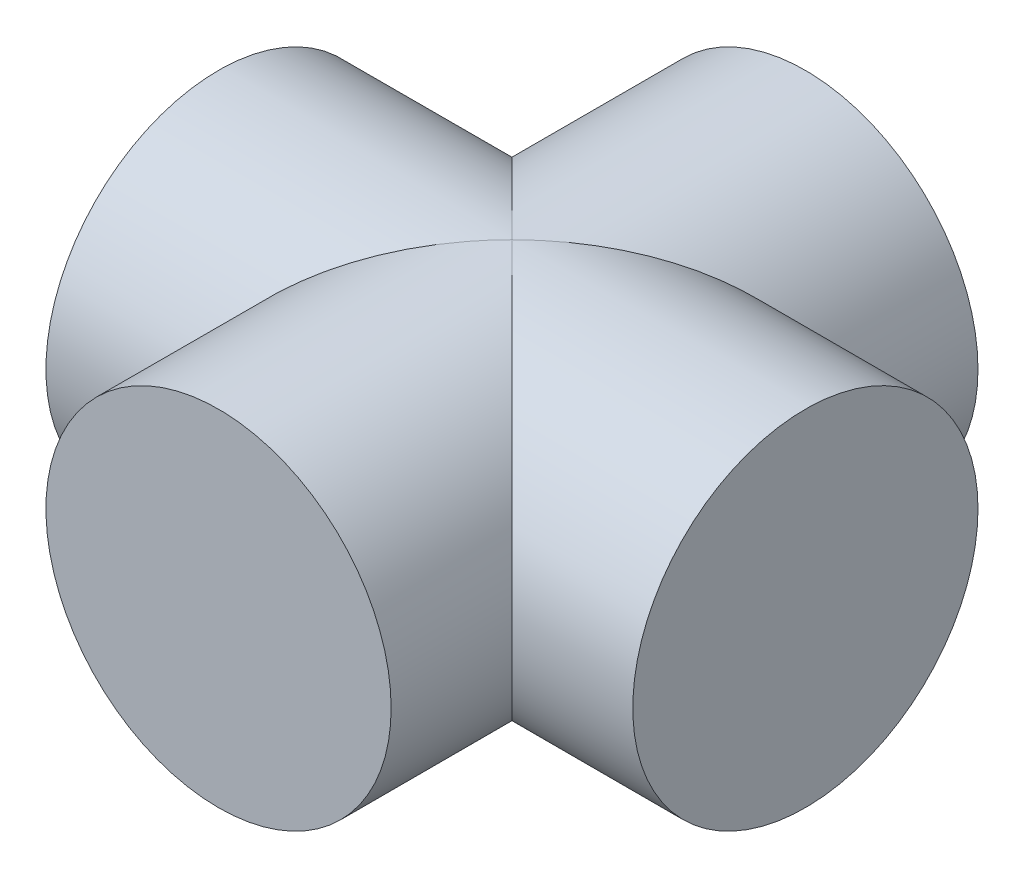
from build123d import *

# Parameters (mm, degrees)
SKETCH1_R                = 7.5
BOSS_EXTRUDE1_DEPTH      = 25.5
BOSS_EXTRUDE2_DEPTH      = 12.75
BOSS_EXTRUDE2_DEPTH_BACK = 12.75
SKETCH2_R                = 7.5


with BuildPart() as part:
    # Sketch1 → Boss-Extrude1 (new body)
    with BuildSketch(Plane.XY):
        Circle(SKETCH1_R)
    extrude(amount=BOSS_EXTRUDE1_DEPTH)

    # Sketch2 → Boss-Extrude2 (add, two sides: drawn at the far end of the back side and taken through both)
    with BuildSketch(Plane(origin=(0, 0, 0), x_dir=(0, 0, -1), z_dir=(1, 0, 0)).offset(-BOSS_EXTRUDE2_DEPTH_BACK)):
        with Locations((-12.75, 0)):
            Circle(SKETCH2_R)
    extrude(amount=BOSS_EXTRUDE2_DEPTH + BOSS_EXTRUDE2_DEPTH_BACK)


solid = part.part
